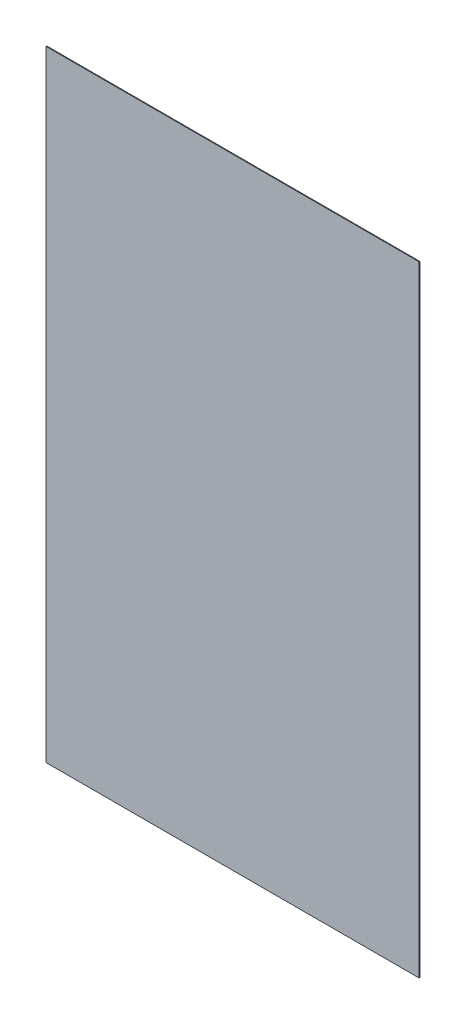
from build123d import *

# Parameters (mm, degrees)
SKETCH1_W           = 1000
SKETCH1_H           = 1662.9
BOSS_EXTRUDE1_DEPTH = 2


with BuildPart() as part:
    # Sketch1 → Boss-Extrude1 (new body)
    with BuildSketch(Plane.XY):
        with Locations((500, 831.45)):
            Rectangle(SKETCH1_W, SKETCH1_H)
    extrude(amount=BOSS_EXTRUDE1_DEPTH)


solid = part.part
